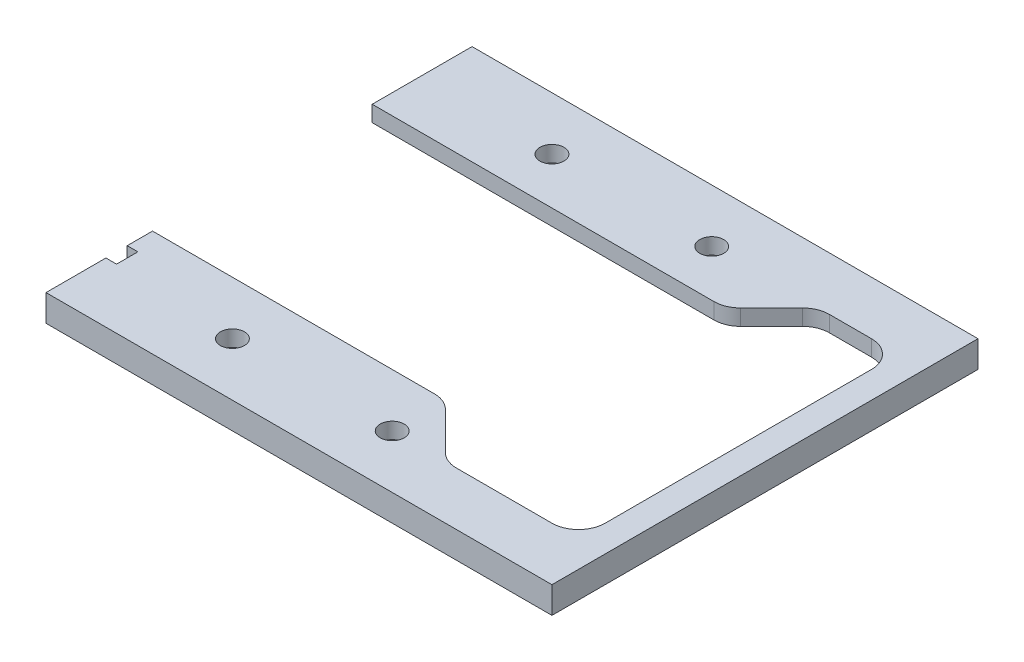
from build123d import *

# Parameters (mm, degrees)
SKETCH1_W           = 190
SKETCH1_H           = 140
BOSS_EXTRUDE1_DEPTH = 6
CUT_EXTRUDE1_DEPTH  = 10
SKETCH4_W           = 5
SKETCH4_H           = 140
BOSS_EXTRUDE4_DEPTH = 4
SKETCH8_W           = 190
SKETCH8_H           = 10
BOSS_EXTRUDE8_DEPTH = 10
SKETCH9_W           = 190
SKETCH9_H           = 10
BOSS_EXTRUDE9_DEPTH = 10
SKETCH10_W          = 4
SKETCH10_H          = 8
CUT_EXTRUDE3_DEPTH  = 10
SKETCH11_R          = 3
CUT_EXTRUDE4_DEPTH  = 10
SKETCH12_R          = 4.5
CUT_EXTRUDE6_DEPTH  = 243.148714636
SKETCH3_W           = 150
SKETCH3_H           = 82.5
CUT_EXTRUDE7_DEPTH  = 10
CUT_EXTRUDE9_DEPTH  = 10


with BuildPart() as part:
    # Sketch1 → Boss-Extrude1 (new body)
    with BuildSketch(Plane(origin=(0, 0, 0), x_dir=(1, 0, 0), z_dir=(0, 1, 0))):
        with Locations((95, 70)):
            Rectangle(SKETCH1_W, SKETCH1_H)
    extrude(amount=BOSS_EXTRUDE1_DEPTH)

    # Sketch2 → Cut-Extrude1 (cut)
    with BuildSketch(Plane(origin=(0, 6, 0), x_dir=(1, 0, 0), z_dir=(0, 1, 0))):
        with BuildLine():
            Line((147.071067812, 127.071067812), (112.928932188, 92.928932188))
            ThreePointArc((112.928932188, 92.928932188), (109.6846987, 90.761204675), (105.857864376, 90))
            Line((105.857864376, 90), (0, 90))
            Line((0, 90), (0, 77.5))
            Line((0, 77.5), (94.092172608, 77.5))
            ThreePointArc((94.092172608, 77.5), (95.939931673, 76.265366865), (95.50638617, 74.085786438))
            Line((95.50638617, 74.085786438), (86.849531921, 65.428932188))
            ThreePointArc((86.849531921, 65.428932188), (83.605298432, 63.261204675), (79.778464109, 62.5))
            Line((79.778464109, 62.5), (30.446951372, 62.5))
            Line((30.446951372, 62.5), (0, 62.5))
            Line((0, 62.5), (0, 47.5))
            Line((0, 47.5), (88.357864376, 47.5))
            ThreePointArc((88.357864376, 47.5), (92.1846987, 46.738795325), (95.428932188, 44.571067812))
            Line((95.428932188, 44.571067812), (127.071067812, 12.928932188))
            ThreePointArc((127.071067812, 12.928932188), (130.3153013, 10.761204675), (134.142135624, 10))
            Line((134.142135624, 10), (170, 10))
            ThreePointArc((170, 10), (177.071067812, 12.928932188), (180, 20))
            Line((180, 20), (180, 120))
            ThreePointArc((180, 120), (177.071067812, 127.071067812), (170, 130))
            Line((170, 130), (154.142135624, 130))
            ThreePointArc((154.142135624, 130), (150.3153013, 129.238795325), (147.071067812, 127.071067812))
        make_face()
        with BuildLine():
            Line((94.092172608, 77.5), (0, 77.5))
            Line((0, 77.5), (0, 62.5))
            Line((0, 62.5), (30.446951372, 62.5))
            Line((30.446951372, 62.5), (79.778464109, 62.5))
            ThreePointArc((79.778464109, 62.5), (83.605298432, 63.261204675), (86.849531921, 65.428932188))
            Line((86.849531921, 65.428932188), (95.50638617, 74.085786438))
            ThreePointArc((95.50638617, 74.085786438), (95.939931673, 76.265366865), (94.092172608, 77.5))
        make_face()
    extrude(amount=-CUT_EXTRUDE1_DEPTH, mode=Mode.SUBTRACT)

    # Sketch4 → Boss-Extrude4 (add)
    with BuildSketch(Plane.XZ):
        with Locations((187.5, -70)):
            Rectangle(SKETCH4_W, SKETCH4_H)
    extrude(amount=BOSS_EXTRUDE4_DEPTH)

    # Sketch8 → Boss-Extrude8 (add)
    with BuildSketch(Plane.XY):
        with Locations((95, 1)):
            Rectangle(SKETCH8_W, SKETCH8_H)
    extrude(amount=BOSS_EXTRUDE8_DEPTH)

    # Sketch9 → Boss-Extrude9 (add)
    with BuildSketch(Plane(origin=(0, 0, -140), x_dir=(-1, 0, 0), z_dir=(0, 0, -1))):
        with Locations((-95, 1)):
            Rectangle(SKETCH9_W, SKETCH9_H)
    extrude(amount=BOSS_EXTRUDE9_DEPTH)

    # Sketch10 → Cut-Extrude3 (cut)
    with BuildSketch(Plane.XZ):
        with Locations((2, -16.5)):
            Rectangle(SKETCH10_W, SKETCH10_H)
    extrude(amount=-CUT_EXTRUDE3_DEPTH, mode=Mode.SUBTRACT)

    # Sketch11 → Cut-Extrude4 (cut)
    with BuildSketch(Plane(origin=(0, 6, 0), x_dir=(1, 0, 0), z_dir=(0, 1, 0))):
        with Locations(Location((50, 10, 0), (0, 0, 270))):
            Circle(SKETCH11_R)
        with Locations(Location((110, 10, 0), (0, 0, 270))):
            Circle(SKETCH11_R)
        with Locations(Location((110, 130, 0), (0, 0, 90))):
            Circle(SKETCH11_R)
        with Locations(Location((50, 130, 0), (0, 0, 90))):
            Circle(SKETCH11_R)
    extrude(amount=-CUT_EXTRUDE4_DEPTH, mode=Mode.SUBTRACT)

    # Sketch12 → Cut-Extrude6 (cut, through all)
    with BuildSketch(Plane(origin=(0, 0, 0), x_dir=(1, 0, 0), z_dir=(0, 1, 0))):
        with Locations(Location((50, 10, 0), (0, 0, 270))):
            Circle(SKETCH12_R)
        with Locations(Location((110, 10, 0), (0, 0, 270))):
            Circle(SKETCH12_R)
        with Locations(Location((110, 130, 0), (0, 0, 90))):
            Circle(SKETCH12_R)
        with Locations(Location((50, 130, 0), (0, 0, 90))):
            Circle(SKETCH12_R)
    extrude(amount=CUT_EXTRUDE6_DEPTH, mode=Mode.SUBTRACT)

    # Sketch3 → Cut-Extrude7 (cut)
    with BuildSketch(Plane(origin=(0, 6, 0), x_dir=(1, 0, 0), z_dir=(0, 1, 0))):
        with Locations((75, 71.25)):
            Rectangle(SKETCH3_W, SKETCH3_H)
    extrude(amount=-CUT_EXTRUDE7_DEPTH, mode=Mode.SUBTRACT)

    # Sketch14 → Cut-Extrude9 (cut)
    with BuildSketch(Plane(origin=(0, 6, 0), x_dir=(1, 0, 0), z_dir=(0, 1, 0))):
        with BuildLine():
            Line((127.071067812, 12.928932188), (112.928932188, 27.071067812))
            ThreePointArc((112.928932188, 27.071067812), (109.6846987, 29.238795325), (105.857864376, 30))
            Line((105.857864376, 30), (0, 30))
            Line((0, 30), (0, 112.5))
            Line((0, 112.5), (128.357864376, 112.5))
            ThreePointArc((128.357864376, 112.5), (132.1846987, 113.261204675), (135.428932188, 115.428932188))
            Line((135.428932188, 115.428932188), (147.071067812, 127.071067812))
            Line((147.071067812, 127.071067812), (147.071067812, 92.661701481))
            Line((147.071067812, 92.661701481), (127.071067812, 12.928932188))
        make_face()
    extrude(amount=-CUT_EXTRUDE9_DEPTH, mode=Mode.SUBTRACT)


solid = part.part
